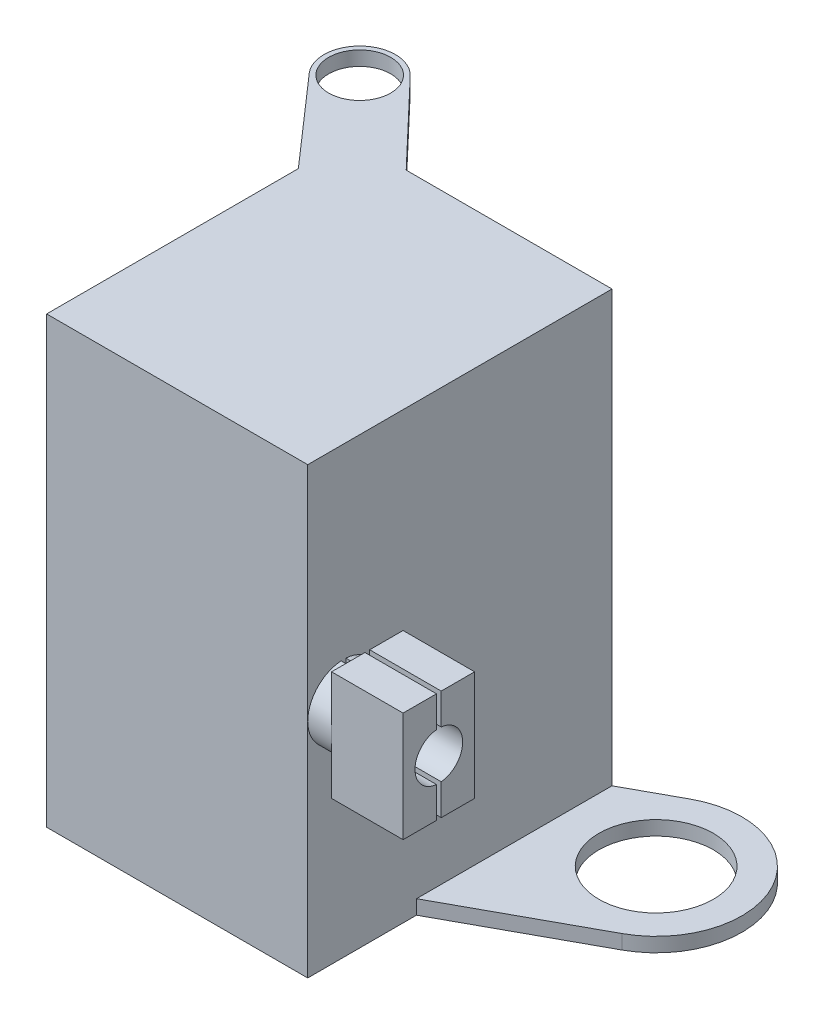
from build123d import *

# Parameters (mm, degrees)
SKETCH2_R           = 6.5
BOSS_EXTRUDE1_DEPTH = 2
BOSS_EXTRUDE2_DEPTH = 90.25
BOSS_EXTRUDE3_START = 90.25
SKETCH2_4_R         = 6.5
BOSS_EXTRUDE3_DEPTH = 3
BOSS_EXTRUDE4_DEPTH = 20
BOSS_EXTRUDE5_START = 5
BOSS_EXTRUDE5_DEPTH = 15
SKETCH4_R           = 18
SKETCH4_R_2         = 12
BOSS_EXTRUDE6_DEPTH = 3


with BuildPart() as part:
    # Sketch2 → Boss-Extrude1 (new body)
    with BuildSketch(Plane(origin=(0, 0, 0), x_dir=(1, 0, 0), z_dir=(0, 1, 0))):
        with BuildLine():
            Line((-43.540750747, 45.85713332), (-27.367167941, 27.4))
            Line((-27.367167941, 27.4), (-27.367167941, -25.4))
            Line((-27.367167941, -25.4), (27.4, -25.4))
            Line((27.4, -25.4), (27.4, 38.429357381))
            Line((27.4, 38.429357381), (-15.776081894, 38.429357381))
            Line((-15.776081894, 38.429357381), (-32.466678415, 55.970011272))
            ThreePointArc((-32.466678415, 55.970011272), (-42.957502529, 56.338200806), (-43.540750747, 45.85713332))
        make_face()
        with Locations(Location((-37.9, 50.8, 0), (0, 0, 270))):
            Circle(SKETCH2_R, mode=Mode.SUBTRACT)
    extrude(amount=BOSS_EXTRUDE1_DEPTH)

    # Sketch2<3> → Boss-Extrude2 (add)
    with BuildSketch(Plane(origin=(0, 0, 0), x_dir=(1, 0, 0), z_dir=(0, 1, 0))):
        Polygon((-24.867167941, -23.4), (-27.367167941, -25.4), (27.4, -25.4), (27.4, 38.429357381), (25.4, 38.429357381), (25.4, -23.4), align=None)
    extrude(amount=BOSS_EXTRUDE2_DEPTH)

    # Sketch2<4> → Boss-Extrude3 (add)
    with BuildSketch(Plane(origin=(0, 0, 0), x_dir=(1, 0, 0), z_dir=(0, 1, 0)).offset(BOSS_EXTRUDE3_START)):
        with BuildLine():
            Line((-43.540750747, 45.85713332), (-27.367167941, 27.4))
            Line((-27.367167941, 27.4), (-27.367167941, -25.4))
            Line((-27.367167941, -25.4), (27.4, -25.4))
            Line((27.4, -25.4), (27.4, 38.429357381))
            Line((27.4, 38.429357381), (-15.776081894, 38.429357381))
            Line((-15.776081894, 38.429357381), (-32.466678415, 55.970011272))
            ThreePointArc((-32.466678415, 55.970011272), (-42.957502529, 56.338200806), (-43.540750747, 45.85713332))
        make_face()
        with Locations(Location((-37.9, 50.8, 0), (0, 0, 270))):
            Circle(SKETCH2_4_R, mode=Mode.SUBTRACT)
    extrude(amount=BOSS_EXTRUDE3_DEPTH)

    # Sketch3 → Boss-Extrude4 (add)
    with BuildSketch(Plane(origin=(27.4, 0, 0), x_dir=(0, 0, -1), z_dir=(1, 0, 0))):
        with BuildLine():
            ThreePointArc((-18.4, 41.650062814), (-22.9, 46.625), (-18.4, 51.599937186))
            Line((-18.4, 51.599937186), (-18.4, 54.108314774))
            ThreePointArc((-18.4, 54.108314774), (-25.4, 46.625), (-18.4, 39.141685226))
            Line((-18.4, 39.141685226), (-18.4, 41.650062814))
        make_face()
        with BuildLine():
            Line((-17.4, 54.108314774), (-17.4, 51.599937186))
            ThreePointArc((-17.4, 51.599937186), (-12.9, 46.625), (-17.4, 41.650062814))
            Line((-17.4, 41.650062814), (-17.4, 39.141685226))
            ThreePointArc((-17.4, 39.141685226), (-10.4, 46.625), (-17.4, 54.108314774))
        make_face()
    extrude(amount=BOSS_EXTRUDE4_DEPTH)

    # Sketch3<3> → Boss-Extrude5 (add)
    with BuildSketch(Plane(origin=(27.4, 0, 0), x_dir=(0, 0, -1), z_dir=(1, 0, 0)).offset(BOSS_EXTRUDE5_START)):
        with BuildLine():
            ThreePointArc((-25.4, 46.625), (-23.377225575, 51.748475383), (-18.4, 54.108314774))
            Line((-18.4, 54.108314774), (-18.4, 58.125))
            Line((-18.4, 58.125), (-25.4, 58.125))
            Line((-25.4, 58.125), (-25.4, 46.625))
        make_face()
        with BuildLine():
            Line((-17.4, 58.125), (-17.4, 54.108314774))
            ThreePointArc((-17.4, 54.108314774), (-12.422774425, 51.748475383), (-10.4, 46.625))
            Line((-10.4, 46.625), (-10.4, 58.125))
            Line((-10.4, 58.125), (-17.4, 58.125))
        make_face()
        with BuildLine():
            ThreePointArc((-18.4, 39.141685226), (-23.377225575, 41.501524617), (-25.4, 46.625))
            Line((-25.4, 46.625), (-25.4, 35.125))
            Line((-25.4, 35.125), (-18.4, 35.125))
            Line((-18.4, 35.125), (-18.4, 39.141685226))
        make_face()
        with BuildLine():
            Line((-10.4, 35.125), (-10.4, 46.625))
            ThreePointArc((-10.4, 46.625), (-12.422774425, 41.501524617), (-17.4, 39.141685226))
            Line((-17.4, 39.141685226), (-17.4, 35.125))
            Line((-17.4, 35.125), (-10.4, 35.125))
        make_face()
    extrude(amount=BOSS_EXTRUDE5_DEPTH)

    # Sketch4 → Boss-Extrude6 (add)
    # profile 1 of 3: a face of its own
    with BuildSketch(Plane.XZ):
        with Locations((46.65, -28.429357381)):
            Circle(SKETCH4_R)
        with Locations(Location((46.65, -28.429357381, 0), (0, 0, 270))):
            Circle(SKETCH4_R_2, mode=Mode.SUBTRACT)
    # profile 2 of 3: a face of its own
    with BuildSketch(Plane.XZ):
        with BuildLine():
            Line((27.4, -17.315364699), (27.4, -38.429357381))
            Line((27.4, -38.429357381), (38.026563161, -44.229241465))
            ThreePointArc((38.026563161, -44.229241465), (30.850115916, -19.805920542), (55.273436839, -12.629473297))
            Line((55.273436839, -12.629473297), (45.117240383, -7.086311195))
            Line((45.117240383, -7.086311195), (27.4, -17.315364699))
        make_face()
    # profile 3 of 3: a face of its own
    with BuildSketch(Plane.XZ):
        Polygon((27.4, 2.583601736), (27.4, -17.315364699), (45.117240383, -7.086311195), align=None)
    extrude(amount=-BOSS_EXTRUDE6_DEPTH)


solid = part.part
